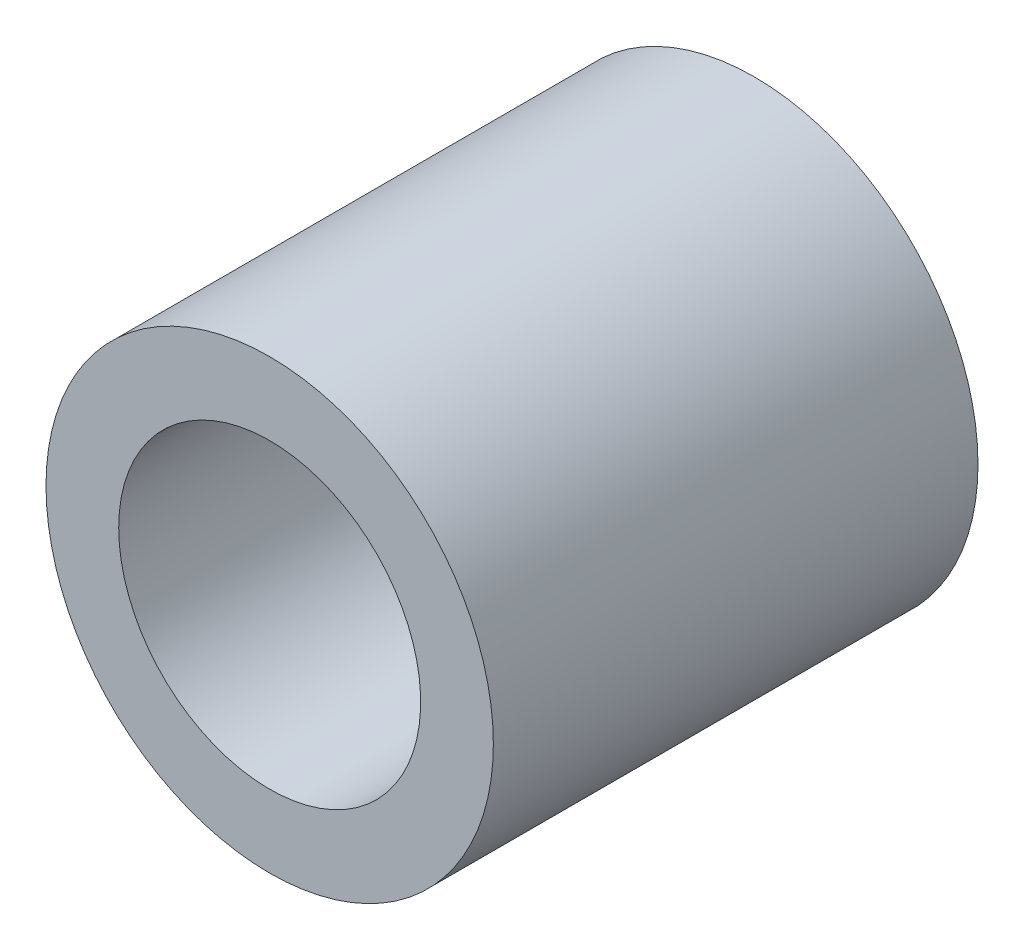
from build123d import *

# Parameters (mm, degrees)
ESQUISSE1_R        = 6
ESQUISSE1_R_2      = 4.05
BOSS_EXTRU_1_DEPTH = 13


with BuildPart() as part:
    # Esquisse1 → Boss.-Extru.1 (new body)
    with BuildSketch(Plane.XY):
        with Locations(Location((0, 0, 0), (0, 0, 180))):
            Circle(ESQUISSE1_R)
        with Locations(Location((0, 0, 0), (0, 0, 180))):
            Circle(ESQUISSE1_R_2, mode=Mode.SUBTRACT)
    extrude(amount=BOSS_EXTRU_1_DEPTH)


solid = part.part
